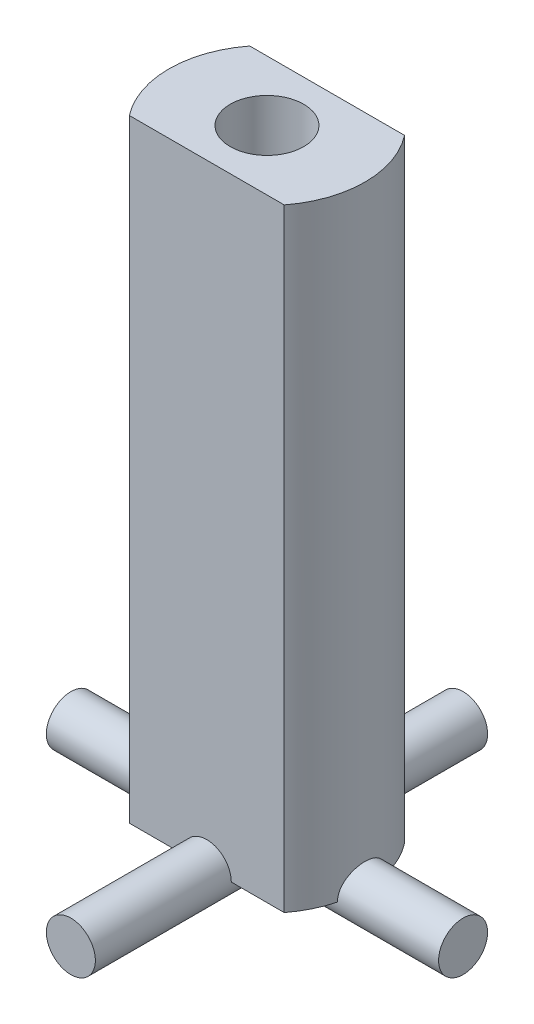
from build123d import *

# Parameters (mm, degrees)
BOSS_EXTRUDE1_DEPTH      = 12.5
SKETCH2_R                = 0.75
CUT_EXTRUDE1_DEPTH       = 4
BOSS_EXTRUDE2_DEPTH      = 4
BOSS_EXTRUDE2_DEPTH_BACK = 4
SKETCH3_R                = 0.5
BOSS_EXTRUDE3_DEPTH      = 4
BOSS_EXTRUDE3_DEPTH_BACK = 4
SKETCH4_R                = 0.5


with BuildPart() as part:
    # Sketch1 → Boss-Extrude1 (new body)
    with BuildSketch(Plane(origin=(0, 0, 0), x_dir=(1, 0, 0), z_dir=(0, 1, 0))):
        with BuildLine():
            Line((-1.578824879, 1.227726355), (1.578824879, 1.227726355))
            ThreePointArc((1.578824879, 1.227726355), (2, 0), (1.578824879, -1.227726355))
            Line((1.578824879, -1.227726355), (-1.578824879, -1.227726355))
            ThreePointArc((-1.578824879, -1.227726355), (-2, 0), (-1.578824879, 1.227726355))
        make_face()
    extrude(amount=BOSS_EXTRUDE1_DEPTH)

    # Sketch2 → Cut-Extrude1 (cut)
    with BuildSketch(Plane(origin=(0, 12.5, 0), x_dir=(1, 0, 0), z_dir=(0, 1, 0))):
        Circle(SKETCH2_R)
    extrude(amount=-CUT_EXTRUDE1_DEPTH, mode=Mode.SUBTRACT)

    # Sketch3 → Boss-Extrude2 (add, two sides: drawn at the far end of the back side and taken through both)
    with BuildSketch(Plane.XY.offset(-BOSS_EXTRUDE2_DEPTH_BACK)):
        Circle(SKETCH3_R)
    extrude(amount=BOSS_EXTRUDE2_DEPTH + BOSS_EXTRUDE2_DEPTH_BACK)

    # Sketch4 → Boss-Extrude3 (add, two sides: drawn at the far end of the back side and taken through both)
    with BuildSketch(Plane(origin=(0, 0, 0), x_dir=(0, 0, -1), z_dir=(1, 0, 0)).offset(-BOSS_EXTRUDE3_DEPTH_BACK)):
        Circle(SKETCH4_R)
    extrude(amount=BOSS_EXTRUDE3_DEPTH + BOSS_EXTRUDE3_DEPTH_BACK)


solid = part.part
